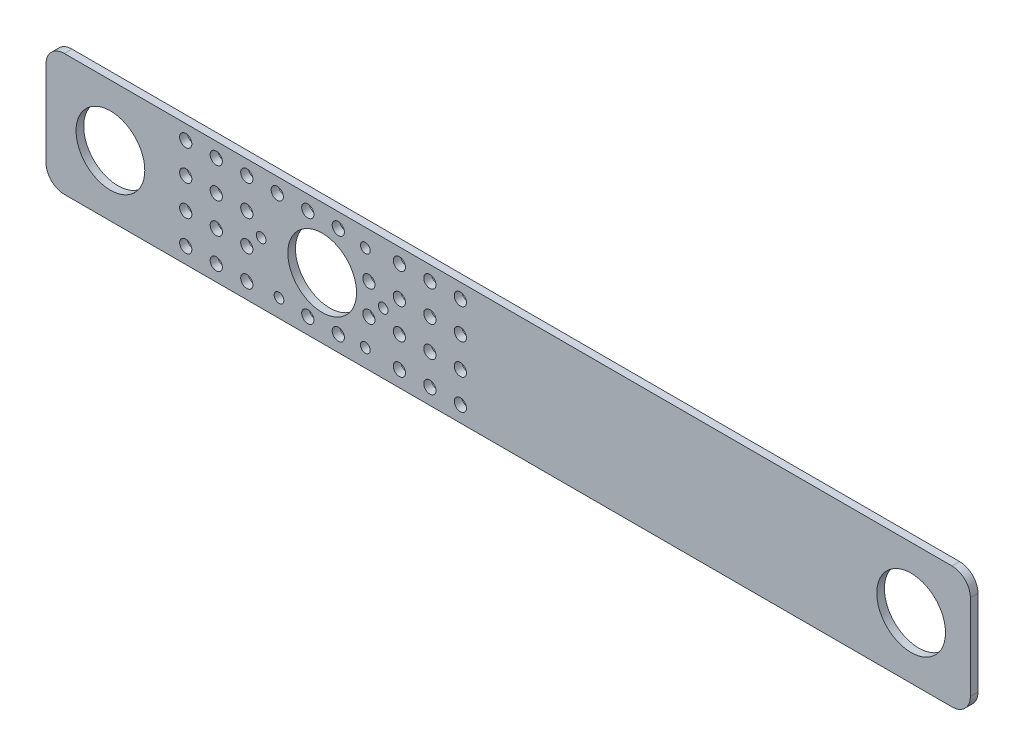
from build123d import *

# Parameters (mm, degrees)
SKETCH1_W           = 384.714130078
SKETCH1_H           = 50.8
SKETCH1_R           = 14.3002
SKETCH1_R_2         = 2.0193
SKETCH1_R_3         = 2.54
BOSS_EXTRUDE1_DEPTH = 3.175
FILLET1_R           = 7.62


with BuildPart() as part:
    # Sketch1 → Boss-Extrude1 (new body)
    with BuildSketch(Plane.XY):
        with Locations((91.437616825, 0.672961839)):
            Rectangle(SKETCH1_W, SKETCH1_H)
        with Locations((-74.109858368, 0.672961839)):
            Circle(SKETCH1_R, mode=Mode.SUBTRACT)
        with Locations((14.028141632, 0.672961839)):
            Circle(SKETCH1_R, mode=Mode.SUBTRACT)
        with Locations((259.138141632, 0.672961839)):
            Circle(SKETCH1_R, mode=Mode.SUBTRACT)
        with Locations((39.42236813, 0.662961839)):
            Circle(SKETCH1_R_2, mode=Mode.SUBTRACT)
        with Locations((31.982880372, -17.297550403)):
            Circle(SKETCH1_R_2, mode=Mode.SUBTRACT)
        with Locations((-3.938144112, -17.297550403)):
            Circle(SKETCH1_R_2, mode=Mode.SUBTRACT)
        with Locations((31.982880372, 18.623474081)):
            Circle(SKETCH1_R_2, mode=Mode.SUBTRACT)
        with Locations((-11.37763187, 0.662961839)):
            Circle(SKETCH1_R_2, mode=Mode.SUBTRACT)
        with Locations((-30.055260848, 7.289574438)):
            Circle(SKETCH1_R_3, mode=Mode.SUBTRACT)
        with Locations((-30.055260848, -5.410425562)):
            Circle(SKETCH1_R_3, mode=Mode.SUBTRACT)
        with Locations((-17.355260848, 7.289574438)):
            Circle(SKETCH1_R_3, mode=Mode.SUBTRACT)
        with Locations((-17.355260848, -5.410425562)):
            Circle(SKETCH1_R_3, mode=Mode.SUBTRACT)
        with Locations((-17.355260848, -18.110425562)):
            Circle(SKETCH1_R_3, mode=Mode.SUBTRACT)
        with Locations((-17.355260848, 19.989574438)):
            Circle(SKETCH1_R_3, mode=Mode.SUBTRACT)
        with Locations((-30.066807854, 19.989574438)):
            Circle(SKETCH1_R_3, mode=Mode.SUBTRACT)
        with Locations((33.444739152, -5.410425562)):
            Circle(SKETCH1_R_3, mode=Mode.SUBTRACT)
        with Locations((33.444739152, 7.289574438)):
            Circle(SKETCH1_R_3, mode=Mode.SUBTRACT)
        with Locations((58.844739152, -5.410425562)):
            Circle(SKETCH1_R_3, mode=Mode.SUBTRACT)
        with Locations((58.844739152, 7.289574438)):
            Circle(SKETCH1_R_3, mode=Mode.SUBTRACT)
        with Locations((46.144739152, 7.289574438)):
            Circle(SKETCH1_R_3, mode=Mode.SUBTRACT)
        with Locations((46.144739152, -5.410425562)):
            Circle(SKETCH1_R_3, mode=Mode.SUBTRACT)
        with Locations((46.144739152, -18.110425562)):
            Circle(SKETCH1_R_3, mode=Mode.SUBTRACT)
        with Locations((58.833192146, -18.110425562)):
            Circle(SKETCH1_R_3, mode=Mode.SUBTRACT)
        with Locations((71.533192146, -18.110425562)):
            Circle(SKETCH1_R_3, mode=Mode.SUBTRACT)
        with Locations((71.533192146, -5.410425562)):
            Circle(SKETCH1_R_3, mode=Mode.SUBTRACT)
        with Locations((71.533192146, 7.289574438)):
            Circle(SKETCH1_R_3, mode=Mode.SUBTRACT)
        with Locations((71.533192146, 19.989574438)):
            Circle(SKETCH1_R_3, mode=Mode.SUBTRACT)
        with Locations((58.833192146, 19.989574438)):
            Circle(SKETCH1_R_3, mode=Mode.SUBTRACT)
        with Locations((46.144739152, 19.989574438)):
            Circle(SKETCH1_R_3, mode=Mode.SUBTRACT)
        with Locations((20.733192146, 19.989574438)):
            Circle(SKETCH1_R_3, mode=Mode.SUBTRACT)
        with Locations((8.033192146, 19.989574438)):
            Circle(SKETCH1_R_3, mode=Mode.SUBTRACT)
        with Locations((-4.666807854, 19.989574438)):
            Circle(SKETCH1_R_3, mode=Mode.SUBTRACT)
        with Locations((20.733192146, -18.110425562)):
            Circle(SKETCH1_R_3, mode=Mode.SUBTRACT)
        with Locations((8.033192146, -18.110425562)):
            Circle(SKETCH1_R_3, mode=Mode.SUBTRACT)
        with Locations((-30.066807854, -18.110425562)):
            Circle(SKETCH1_R_3, mode=Mode.SUBTRACT)
        with Locations((-42.766807854, -18.110425562)):
            Circle(SKETCH1_R_3, mode=Mode.SUBTRACT)
        with Locations((-42.766807854, 19.989574438)):
            Circle(SKETCH1_R_3, mode=Mode.SUBTRACT)
        with Locations((-42.766807854, 7.289574438)):
            Circle(SKETCH1_R_3, mode=Mode.SUBTRACT)
        with Locations((-42.766807854, -5.410425562)):
            Circle(SKETCH1_R_3, mode=Mode.SUBTRACT)
    extrude(amount=BOSS_EXTRUDE1_DEPTH)

    # Fillet1
    fillet1_edges = [part.edges().sort_by_distance(p)[0] for p in [
        (-100.919448214, 26.072961839, 1.5875),
        (283.794681864, 26.072961839, 1.5875),
        (283.794681864, -24.727038161, 1.5875),
        (-100.919448214, -24.727038161, 1.5875),
    ]]
    fillet(fillet1_edges, radius=FILLET1_R)


solid = part.part
